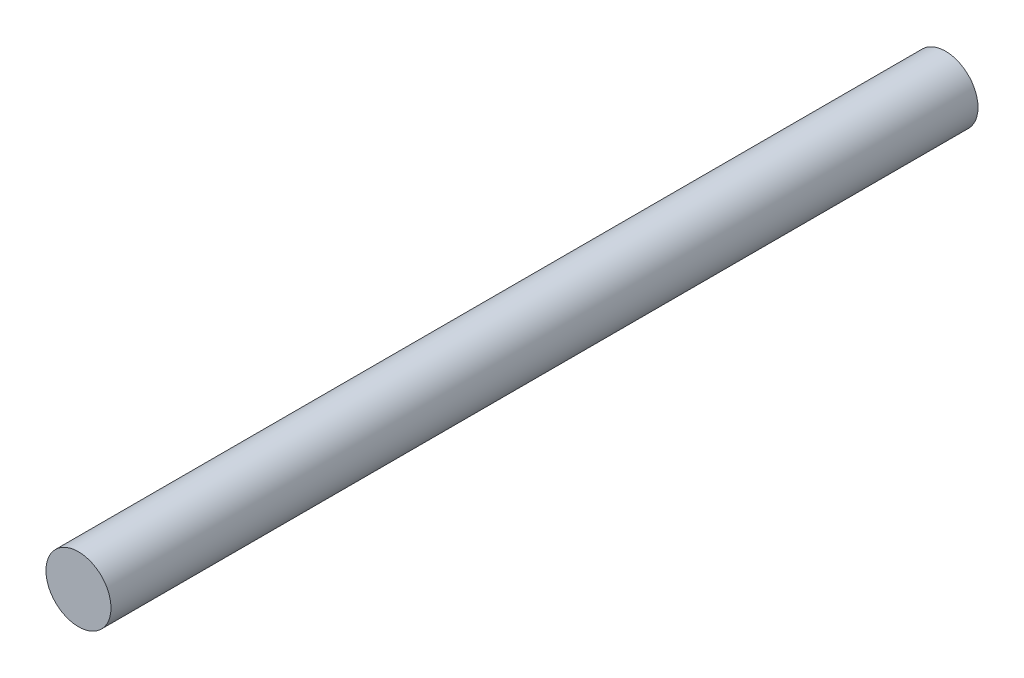
from build123d import *

# Parameters (mm, degrees)
SKETCH_1_R      = 1.5
EXTRUDE_1_DEPTH = 20


with BuildPart() as part:
    # 草图1 → 凸台-拉伸1 (new, symmetric)
    with BuildSketch(Plane.XY):
        Circle(SKETCH_1_R)
    extrude(amount=EXTRUDE_1_DEPTH, both=True)


solid = part.part
